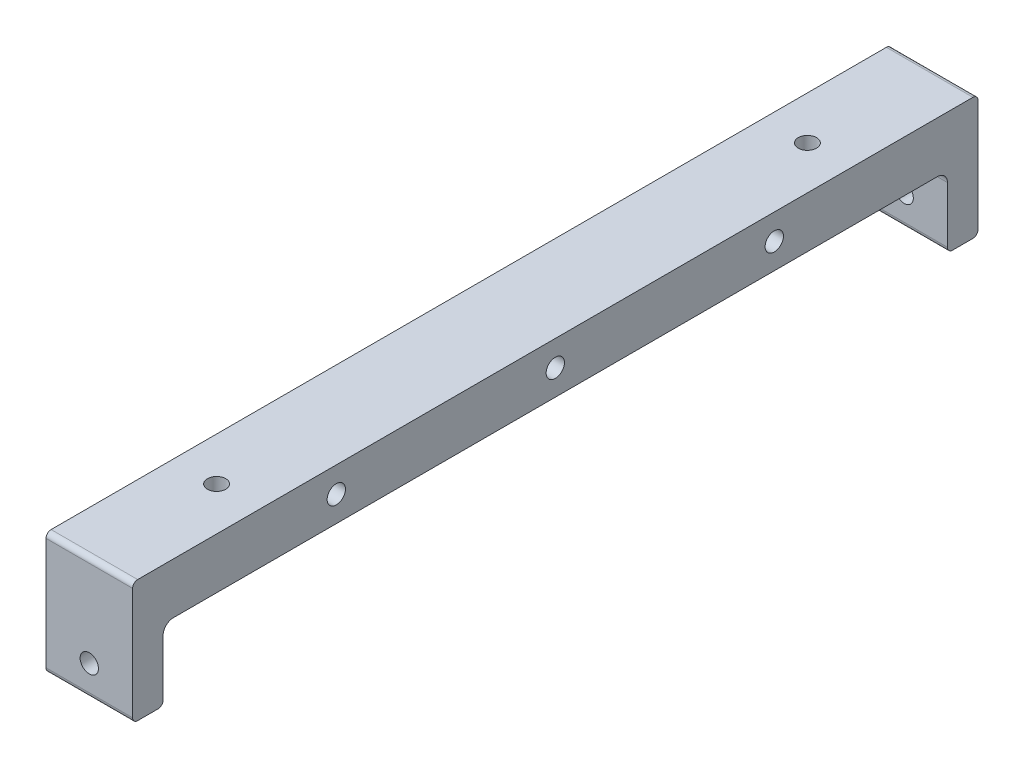
from build123d import *

# Parameters (mm, degrees)
SKETCH1_W                        = 8.5
SKETCH1_H                        = 12
BOSS_EXTRUDE1_DEPTH              = 41.5
CUT_EXTRUDE1_DEPTH               = 43.784342931
M1_6_HOLE1_FIXINGPCB_D           = 1.8
M1_6_HOLE1_FIXINGPCB_CSINK_D     = 3.6
M1_6_HOLE1_FIXINGPCB_CSINK_ANGLE = 90
FILLET1_R                        = 0.5
M1_6_HOLE2_INTUNION_D            = 1.8
M1_6_HOLE2_INTUNION_DEPTH        = 200
M1_6_HOLE2_INTUNION_TIP          = 0.540774557
M1_6_HOLE3_EXTUNION_D            = 1.8
M1_6_HOLE3_EXTUNION_DEPTH        = 3
M1_6_HOLE3_EXTUNION_TIP          = 0.540774557
M1_6_HOLE4_TOPUNION_D            = 1.8
M1_6_HOLE4_TOPUNION_DEPTH        = 3
M1_6_HOLE4_TOPUNION_TIP          = 0.540774557
M1_6_CLEARANCE_HOLE1_D           = 1.8
M1_6_CLEARANCE_HOLE1_DEPTH       = 3
M1_6_CLEARANCE_HOLE1_TIP         = 0.540774557


with BuildPart() as part:
    # Sketch1 → Boss-Extrude1 (new, symmetric)
    with BuildSketch(Plane.XY):
        Rectangle(SKETCH1_W, SKETCH1_H)
    extrude(amount=BOSS_EXTRUDE1_DEPTH, both=True)

    # Sketch2 → Cut-Extrude1 (cut, through all)
    with BuildSketch(Plane(origin=(4.25, 0, 0), x_dir=(0, 0, -1), z_dir=(1, 0, 0))):
        with BuildLine():
            Line((-37.5, 1), (37.5, 1))
            ThreePointArc((37.5, 1), (38.207106781, 0.707106781), (38.5, 0))
            Line((38.5, 0), (38.5, -6))
            Line((38.5, -6), (-38.5, -6))
            Line((-38.5, -6), (-38.5, 0))
            ThreePointArc((-38.5, 0), (-38.207106781, 0.707106781), (-37.5, 1))
        make_face()
    extrude(amount=-CUT_EXTRUDE1_DEPTH, mode=Mode.SUBTRACT)

    # M1.6 Hole1-FixingPCB (through all)
    with Locations(Plane.ZY.offset(4.25)):
        with Locations((-21.5, 3.5), (21.5, 3.5)):
            CounterSinkHole(M1_6_HOLE1_FIXINGPCB_D / 2, M1_6_HOLE1_FIXINGPCB_CSINK_D / 2, counter_sink_angle=M1_6_HOLE1_FIXINGPCB_CSINK_ANGLE)

    # Fillet1
    fillet1_edges = [part.edges().sort_by_distance(p)[0] for p in [
        (0, -6, 41.5),
        (0, -6, -38.5),
        (0, -6, 38.5),
        (0, -6, -41.5),
        (0, 6, -41.5),
        (0, 6, 41.5),
    ]]
    fillet(fillet1_edges, radius=FILLET1_R)

    # M1.6 Hole2-IntUnion
    with Locations(Plane.XY.offset(41.5)):
        with Locations((0, -3)):
            Hole(M1_6_HOLE2_INTUNION_D / 2, depth=M1_6_HOLE2_INTUNION_DEPTH)
            with Locations((0, 0, -(M1_6_HOLE2_INTUNION_DEPTH + M1_6_HOLE2_INTUNION_TIP / 2))):  # 118° drill point
                Cone(0, M1_6_HOLE2_INTUNION_D / 2, M1_6_HOLE2_INTUNION_TIP, mode=Mode.SUBTRACT)

    # M1.6 Hole3-ExtUnion
    with Locations(Plane.ZY.offset(4.25)):
        with Locations((-35.5, 3.5), (35.5, 3.5)):
            Hole(M1_6_HOLE3_EXTUNION_D / 2, depth=M1_6_HOLE3_EXTUNION_DEPTH)
            with Locations((0, 0, -(M1_6_HOLE3_EXTUNION_DEPTH + M1_6_HOLE3_EXTUNION_TIP / 2))):  # 118° drill point
                Cone(0, M1_6_HOLE3_EXTUNION_D / 2, M1_6_HOLE3_EXTUNION_TIP, mode=Mode.SUBTRACT)

    # M1.6 Hole4-TopUnion
    with Locations(Plane(origin=(4.25, 0, 0), x_dir=(0, 0, -1), z_dir=(1, 0, 0))):
        with Locations((0, 3.5)):
            Hole(M1_6_HOLE4_TOPUNION_D / 2, depth=M1_6_HOLE4_TOPUNION_DEPTH)
            with Locations((0, 0, -(M1_6_HOLE4_TOPUNION_DEPTH + M1_6_HOLE4_TOPUNION_TIP / 2))):  # 118° drill point
                Cone(0, M1_6_HOLE4_TOPUNION_D / 2, M1_6_HOLE4_TOPUNION_TIP, mode=Mode.SUBTRACT)

    # M1.6 Clearance Hole1
    with Locations(Plane(origin=(0, 6, 0), x_dir=(1, 0, 0), z_dir=(0, 1, 0))):
        with Locations((0, 29), (0, -29)):
            Hole(M1_6_CLEARANCE_HOLE1_D / 2, depth=M1_6_CLEARANCE_HOLE1_DEPTH)
            with Locations((0, 0, -(M1_6_CLEARANCE_HOLE1_DEPTH + M1_6_CLEARANCE_HOLE1_TIP / 2))):  # 118° drill point
                Cone(0, M1_6_CLEARANCE_HOLE1_D / 2, M1_6_CLEARANCE_HOLE1_TIP, mode=Mode.SUBTRACT)


solid = part.part
